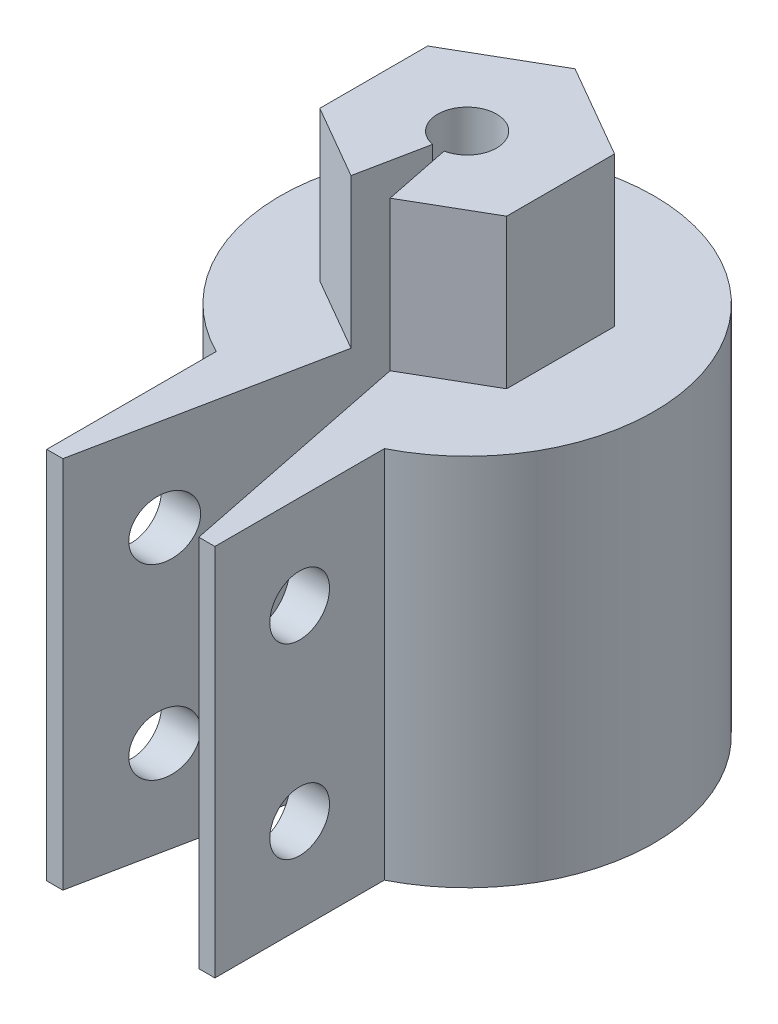
from build123d import *

# Parameters (mm, degrees)
EXTRUDE_1_DEPTH     = 20
EXTRUDE_2_DEPTH     = 8
CUT_EXTRUDE_1_DEPTH = 35.756294394
SKETCH_4_R          = 1.6
CUT_EXTRUDE_2_DEPTH = 37.307712679


with BuildPart() as part:
    # ｽｹｯﾁ1 → ﾎﾞｽ - 押し出し1 (new body)
    with BuildSketch(Plane(origin=(0, 0, 0), x_dir=(1, 0, 0), z_dir=(0, 1, 0))):
        with BuildLine():
            Line((-4.5, -8.93028555), (-4.5, -18))
            Line((-4.5, -18), (4.5, -18))
            Line((4.5, -18), (4.5, -8.93028555))
            ThreePointArc((4.5, -8.93028555), (0, 10), (-4.5, -8.93028555))
        make_face()
    extrude(amount=EXTRUDE_1_DEPTH)

    # ｽｹｯﾁ2 → ﾎﾞｽ - 押し出し2 (add)
    with BuildSketch(Plane(origin=(0, 20, 0), x_dir=(1, 0, 0), z_dir=(0, 1, 0))):
        Polygon((0, 5.773502692), (-5, 2.886751346), (-5, -2.886751346), (0, -5.773502692), (5, -2.886751346), (5, 2.886751346), align=None)
    extrude(amount=EXTRUDE_2_DEPTH)

    # ｽｹｯﾁ3 → ｶｯﾄ - 押し出し1 (cut, through all)
    with BuildSketch(Plane(origin=(0, 28, 0), x_dir=(1, 0, 0), z_dir=(0, 1, 0))):
        with BuildLine():
            Line((-3.638778503, -18), (-0.312080176, -1.543771668))
            ThreePointArc((-0.312080176, -1.543771668), (0, 1.575), (0.312080176, -1.543771668))
            Line((0.312080176, -1.543771668), (3.638778503, -18))
            ThreePointArc((3.638778503, -18), (0, -18.364114708), (-3.638778503, -18))
        make_face()
    extrude(amount=-CUT_EXTRUDE_1_DEPTH, mode=Mode.SUBTRACT)

    # ｽｹｯﾁ4 → ｶｯﾄ - 押し出し2 (cut, through all)
    with BuildSketch(Plane.ZY.offset(4.5)):
        with Locations((13.465142775, 15)):
            Circle(SKETCH_4_R)
        with Locations((13.465142775, 5)):
            Circle(SKETCH_4_R)
    extrude(amount=-CUT_EXTRUDE_2_DEPTH, mode=Mode.SUBTRACT)


solid = part.part
